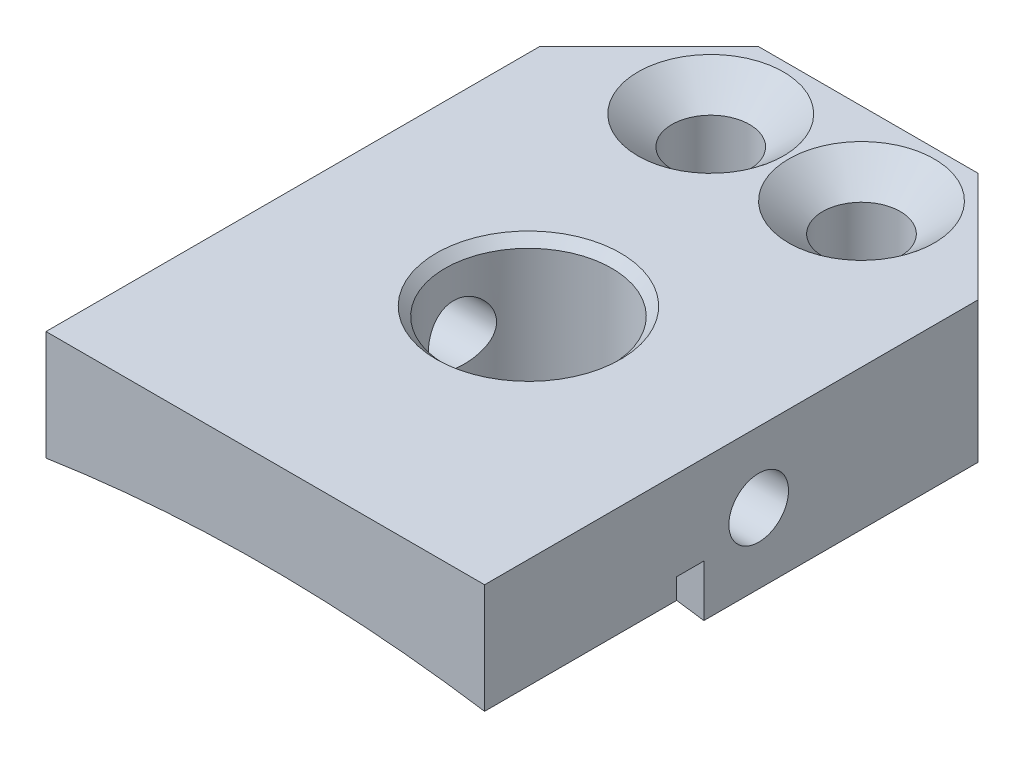
from build123d import *

# Parameters (mm, degrees)
BOSS_EXTRUDE1_DEPTH                               = 6.35
CUT_EXTRUDE1_DEPTH                                = 46.530235335
CUT_EXTRUDE1_DEPTH_BACK                           = 46.530235335
SKETCH2_R                                         = 83.82
BOSS_EXTRUDE2_DEPTH                               = 22.225
CHAMFER1_SIZE                                     = 6.35
CSK_FOR_8_FLAT_HEAD_MACHINE_SCREW_100_D           = 4.4958
CSK_FOR_8_FLAT_HEAD_MACHINE_SCREW_100_CSINK_D     = 8.4328
CSK_FOR_8_FLAT_HEAD_MACHINE_SCREW_100_CSINK_ANGLE = 100
SKETCH6_R                                         = 1.524
CUT_EXTRUDE2_DEPTH                                = 38.145162749
SKETCH7_W                                         = 1.5875
SKETCH7_H                                         = 2.989850087
CUT_EXTRUDE3_DEPTH                                = 35.437066375
SKETCH8_R                                         = 4.826
CUT_EXTRUDE4_DEPTH                                = 38.145162749
CHAMFER2_SIZE                                     = 0.508
F_8_32_TAPPED_HOLE1_D                             = 3.4544


with BuildPart() as part:
    # Sketch1 → Boss-Extrude1 (new body)
    with BuildSketch(Plane(origin=(0, 0, 0), x_dir=(1, 0, 0), z_dir=(0, 1, 0))):
        Polygon((-28.511825699, 16.020271113), (-22.161825699, 22.370271113), (-9.461825699, 22.370271113), (-3.111825699, 16.020271113), (-3.111825699, -12.554728887), (-28.511825699, -12.554728887), align=None)
    extrude(amount=BOSS_EXTRUDE1_DEPTH)

    # Sketch2 → Cut-Extrude1 (cut, two sides: drawn at the far end of the back side and taken through both)
    with BuildSketch(Plane.XY.offset(12.554728887).offset(-CUT_EXTRUDE1_DEPTH_BACK)):
        with Locations((-15.811825699, -82.852292666)):
            Circle(SKETCH2_R)
    extrude(amount=CUT_EXTRUDE1_DEPTH + CUT_EXTRUDE1_DEPTH_BACK, mode=Mode.SUBTRACT)

    # Sketch5 → Boss-Extrude2 (add)
    with BuildSketch(Plane(origin=(0, 0, -22.370271113), x_dir=(-1, 0, 0), z_dir=(0, 0, -1))):
        with BuildLine():
            Line((3.111825699, 6.35), (3.111825699, 0))
            Line((3.111825699, 0), (3.111825699, -1.799225087))
            ThreePointArc((3.111825699, -1.799225087), (15.811825699, -0.810292666), (28.511825699, -1.799225087))
            Line((28.511825699, -1.799225087), (28.511825699, 0))
            Line((28.511825699, 0), (28.511825699, 6.35))
            Line((28.511825699, 6.35), (3.111825699, 6.35))
        make_face()
    extrude(amount=-BOSS_EXTRUDE2_DEPTH)

    # Chamfer1
    chamfer1_edges = [part.edges().sort_by_distance(p)[0] for p in [
        (-3.111825699, 2.275387457, -22.370271113),
        (-28.511825699, 2.275387457, -22.370271113),
    ]]
    chamfer(chamfer1_edges, length=CHAMFER1_SIZE)

    # CSK for #8 Flat Head Machine Screw (100)1 (through all)
    with Locations(Plane(origin=(0, 6.35, 0), x_dir=(1, 0, 0), z_dir=(0, 1, 0))):
        with Locations((-20.177450699, 17.607771113), (-11.446200699, 17.607771113)):
            CounterSinkHole(CSK_FOR_8_FLAT_HEAD_MACHINE_SCREW_100_D / 2, CSK_FOR_8_FLAT_HEAD_MACHINE_SCREW_100_CSINK_D / 2, counter_sink_angle=CSK_FOR_8_FLAT_HEAD_MACHINE_SCREW_100_CSINK_ANGLE)

    # Sketch6 → Cut-Extrude2 (cut, through all)
    with BuildSketch(Plane(origin=(0, 6.35, 0), x_dir=(1, 0, 0), z_dir=(0, 1, 0))):
        with Locations(Location((-15.811825699, 2.685271113, 0), (0, 0, 270))):
            Circle(SKETCH6_R)
    extrude(amount=-CUT_EXTRUDE2_DEPTH, mode=Mode.SUBTRACT)

    # Sketch7 → Cut-Extrude3 (cut, through all)
    with BuildSketch(Plane(origin=(-3.111825699, 0, 0), x_dir=(0, 0, -1), z_dir=(1, 0, 0))):
        with Locations((-0.648478887, -0.304300044)):
            Rectangle(SKETCH7_W, SKETCH7_H)
    extrude(amount=-CUT_EXTRUDE3_DEPTH, mode=Mode.SUBTRACT)

    # Sketch8 → Cut-Extrude4 (cut, through all)
    with BuildSketch(Plane(origin=(0, 6.35, 0), x_dir=(1, 0, 0), z_dir=(0, 1, 0))):
        with Locations(Location((-15.811825699, 2.685271113, 0), (0, 0, 270))):
            Circle(SKETCH8_R)
    extrude(amount=-CUT_EXTRUDE4_DEPTH, mode=Mode.SUBTRACT)

    # Chamfer2
    chamfer2_edges = [part.edges().sort_by_distance(p)[0] for p in [
        (-15.811825699, 6.35, -7.511271113),
    ]]
    chamfer(chamfer2_edges, length=CHAMFER2_SIZE)

    # #8-32 Tapped Hole1 (through all)
    with Locations(Plane.ZY.offset(28.511825699)):
        with Locations((-3.320271113, 2.275387457)):
            Hole(F_8_32_TAPPED_HOLE1_D / 2)


solid = part.part
